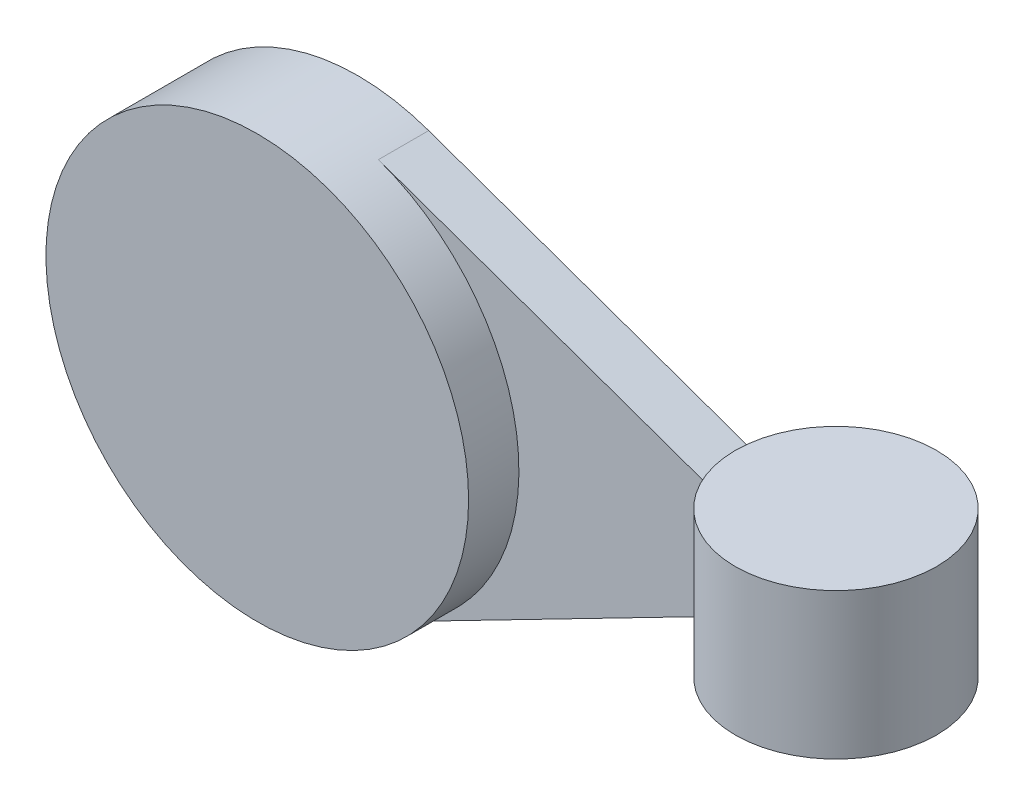
from build123d import *

# Parameters (mm, degrees)
SKETCH_1_R          = 42
EXTRUDE_1_DEPTH     = 20
EXTRUDE_2_DEPTH     = 5
SKETCH_4_R          = 42
CUT_EXTRUDE_1_DEPTH = 15
SKETCH_5_R          = 42
EXTRUDE_3_DEPTH     = 10


with BuildPart() as part:
    # 草图1 → 凸台-拉伸1 (new body)
    with BuildSketch(Plane.XY):
        Circle(SKETCH_1_R)
    extrude(amount=EXTRUDE_1_DEPTH)



with BuildPart() as body_2:
    # 草图2 → 旋转1 (revolve)
    with BuildSketch(Plane.XY.offset(20), mode=Mode.PRIVATE) as revolve_1_sk:
        with BuildLine():
            Line((100, 20), (100, 15))
            ThreePointArc((100, 15), (86.583592135, 6.708203932), (88, -9))
            Line((88, -9), (80, -9))
            Line((80, -9), (80, 20))
            Line((80, 20), (100, 20))
        make_face()
    revolve(revolve_1_sk.sketch.rotate(Axis((100, 22.717290725, 20), (0, -1, 0)), 270), axis=Axis((100, 22.717290725, 20), (0, -1, 0)))


with BuildPart() as part_1:
    add(part.part)

    add(body_2.part)  # 凸台-拉伸2 merges body 2
    # 草图3 → 凸台-拉伸2 (add, symmetric)
    with BuildSketch(Plane.XY.offset(20)):
        with BuildLine():
            Line((14.069453744, 39.573355574), (86, 14))
            Line((86, 14), (86, -3))
            Line((86, -3), (19.208719722, -37.350034627))
            ThreePointArc((19.208719722, -37.350034627), (-41.906577017, -2.79978619), (14.069453744, 39.573355574))
        make_face()
    extrude(amount=EXTRUDE_2_DEPTH, both=True)

    # 草图4 → 切除-拉伸1 (cut)
    with BuildSketch(Plane(origin=(0, 0, 0), x_dir=(-1, 0, 0), z_dir=(0, 0, -1))):
        Circle(SKETCH_4_R)
    extrude(amount=-CUT_EXTRUDE_1_DEPTH, mode=Mode.SUBTRACT)

    # 草图5 → 凸台-拉伸3 (add)
    with BuildSketch(Plane.XY.offset(25)):
        with Locations(Location((0, 0, 0), (0, 0, 70.428252948))):
            Circle(SKETCH_5_R)
    extrude(amount=EXTRUDE_3_DEPTH)


solid = part_1.part
